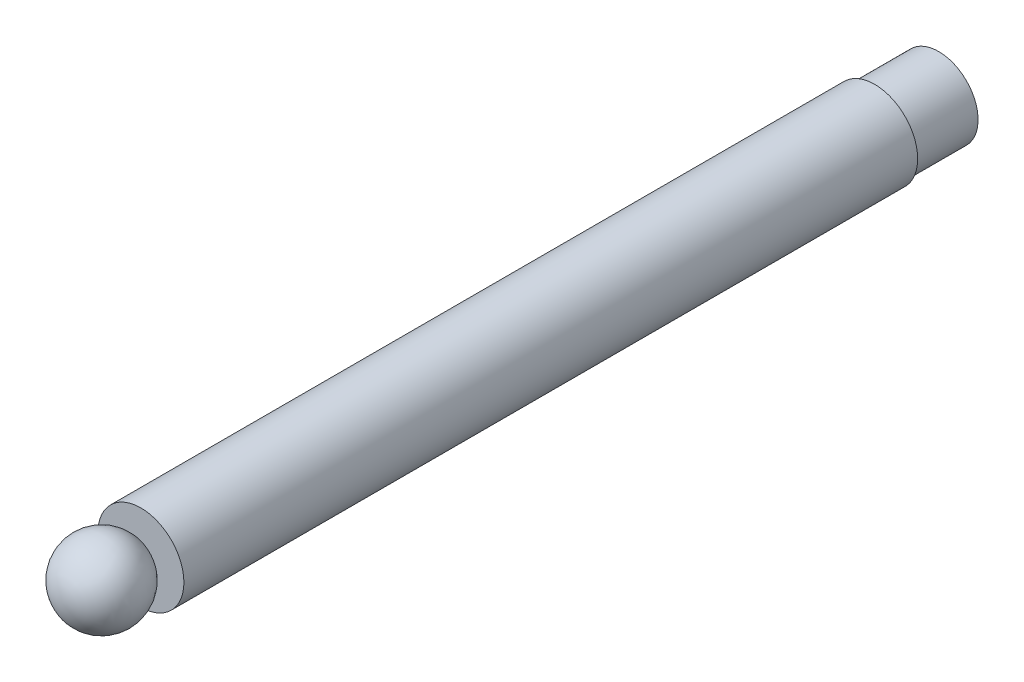
from build123d import *

# Parameters (mm, degrees)
SKETCH1_R           = 8
BOSS_EXTRUDE1_DEPTH = 13
SKETCH2_R           = 8.733340629
BOSS_EXTRUDE2_DEPTH = 149


with BuildPart() as part:
    # Sketch1 → Boss-Extrude1 (new body)
    with BuildSketch(Plane.XY):
        with Locations(Location((0, 0, 0), (0, 0, 180))):
            Circle(SKETCH1_R)
    extrude(amount=BOSS_EXTRUDE1_DEPTH)

    # Sketch2 → Boss-Extrude2 (add)
    with BuildSketch(Plane.XY.offset(13)):
        Circle(SKETCH2_R)
    extrude(amount=BOSS_EXTRUDE2_DEPTH)


with BuildPart() as body_2:
    # Sketch3 → Revolve1 (revolve)
    with BuildSketch(Plane(origin=(0, 0, 0), x_dir=(1, 0, 0), z_dir=(0, 1, 0))):
        with BuildLine():
            Line((0, -162), (0, -178))
            ThreePointArc((0, -178), (8, -170), (0, -162))
        make_face()
    revolve(axis=Axis((0, 0, 162), (0, 0, 1)))


solid = Compound([part.part, body_2.part])
